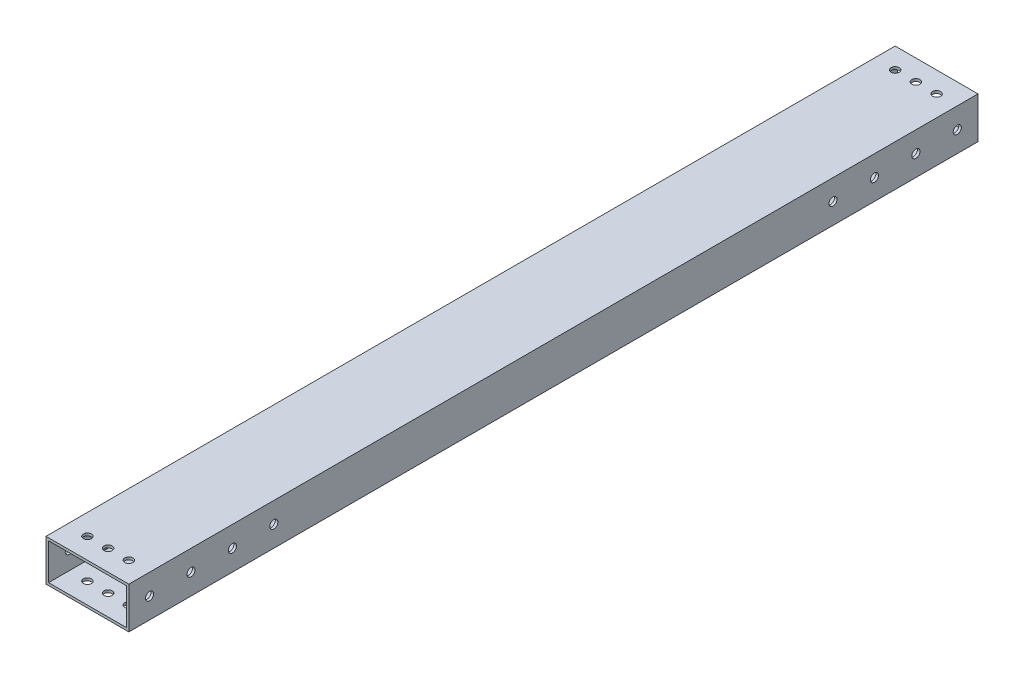
from build123d import *

# Parameters (mm, degrees)
SKETCH1_W           = 50.8
SKETCH1_H           = 25.4
SKETCH1_W_2         = 47.625
SKETCH1_H_2         = 22.225
BOSS_EXTRUDE1_DEPTH = 260.35
SKETCH2_R           = 2.4892
CUT_EXTRUDE1_DEPTH  = 263.8163665
SKETCH3_R           = 2.4892
CUT_EXTRUDE2_DEPTH  = 266.563650562


with BuildPart() as part:
    # Sketch1 → Boss-Extrude1 (new, symmetric)
    with BuildSketch(Plane.XY):
        Rectangle(SKETCH1_W, SKETCH1_H)
        Rectangle(SKETCH1_W_2, SKETCH1_H_2, mode=Mode.SUBTRACT)
    extrude(amount=BOSS_EXTRUDE1_DEPTH, both=True)

    # Sketch2 → Cut-Extrude1 (cut, through all)
    with BuildSketch(Plane(origin=(0, 12.7, 0), x_dir=(1, 0, 0), z_dir=(0, 1, 0))):
        with Locations(Location((-12.7, 247.65, 0), (0, 0, 270))):
            Circle(SKETCH2_R)
        with Locations(Location((0, 247.65, 0), (0, 0, 270))):
            Circle(SKETCH2_R)
        with Locations(Location((12.7, 247.65, 0), (0, 0, 270))):
            Circle(SKETCH2_R)
        with Locations((12.7, -247.65)):
            Circle(SKETCH2_R)
        with Locations((0, -247.65)):
            Circle(SKETCH2_R)
        with Locations((-12.7, -247.65)):
            Circle(SKETCH2_R)
    extrude(amount=-CUT_EXTRUDE1_DEPTH, mode=Mode.SUBTRACT)

    # Sketch3 → Cut-Extrude2 (cut, through all)
    with BuildSketch(Plane(origin=(25.4, 0, 0), x_dir=(0, 0, -1), z_dir=(1, 0, 0))):
        with Locations((247.65, 0)):
            Circle(SKETCH3_R)
        with Locations(Location((-247.65, 0, 0), (0, 0, 180))):
            Circle(SKETCH3_R)
        with Locations((222.25, 0)):
            Circle(SKETCH3_R)
        with Locations((196.85, 0)):
            Circle(SKETCH3_R)
        with Locations((171.45, 0)):
            Circle(SKETCH3_R)
        with Locations(Location((-171.45, 0, 0), (0, 0, 180))):
            Circle(SKETCH3_R)
        with Locations(Location((-196.85, 0, 0), (0, 0, 180))):
            Circle(SKETCH3_R)
        with Locations(Location((-222.25, 0, 0), (0, 0, 180))):
            Circle(SKETCH3_R)
    extrude(amount=-CUT_EXTRUDE2_DEPTH, mode=Mode.SUBTRACT)


solid = part.part
